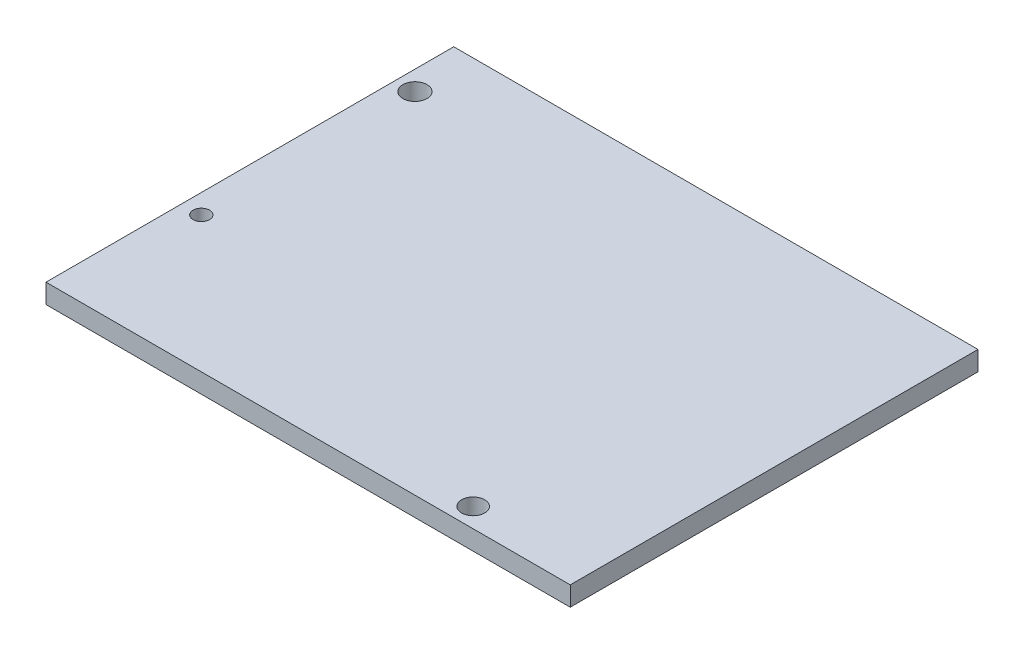
from build123d import *

# Parameters (mm, degrees)
SKETCH2_W      = 68.58
SKETCH2_H      = 53.34
SKETCH2_R      = 1.58353158
SKETCH2_R_2    = 1.50705101
SKETCH2_R_3    = 1.0795
EXTRUDE1_DEPTH = 2.54


with BuildPart() as part:
    # Sketch2 → Extrude1 (new body)
    with BuildSketch(Plane(origin=(0, 0, 0), x_dir=(1, 0, 0), z_dir=(0, 1, 0))):
        with Locations((36.552617603, -17.1846875)):
            Rectangle(SKETCH2_W, SKETCH2_H)
        with Locations(Location((4.802617603, 1.8653125, 0), (0, 0, 270))):
            Circle(SKETCH2_R, mode=Mode.SUBTRACT)
        with Locations(Location((55.602566803, -41.3146875, 0), (0, 0, 270))):
            Circle(SKETCH2_R_2, mode=Mode.SUBTRACT)
        with Locations(Location((4.802617603, -26.0746875, 0), (0, 0, 270))):
            Circle(SKETCH2_R_3, mode=Mode.SUBTRACT)
    extrude(amount=EXTRUDE1_DEPTH)


solid = part.part
